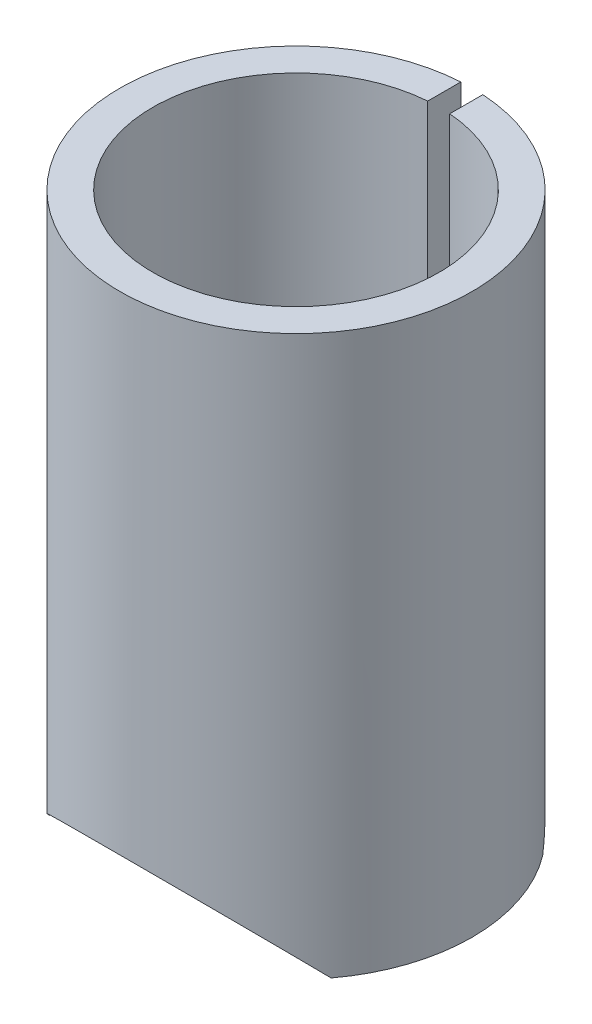
from build123d import *

# Parameters (mm, degrees)
BOSS_EXTRUDE1_DEPTH     = 50.8
CUT_EXTRUDE1_DEPTH      = 50.8
CUT_EXTRUDE1_DEPTH_BACK = 50.8
SKETCH2_R               = 15.875


with BuildPart() as part:
    # Sketch1 → Boss-Extrude1 (new body)
    with BuildSketch(Plane(origin=(0, 0, 0), x_dir=(1, 0, 0), z_dir=(0, 1, 0))):
        with BuildLine():
            Line((-1, 15.968719423), (-1, 12.961481397))
            ThreePointArc((-1, 12.961481397), (0, -13), (1, 12.961481397))
            Line((1, 12.961481397), (1, 15.968719423))
            ThreePointArc((1, 15.968719423), (0, -16), (-1, 15.968719423))
        make_face()
    extrude(amount=BOSS_EXTRUDE1_DEPTH)

    # Sketch2 → Cut-Extrude1 (cut, two sides: drawn at the far end of the back side and taken through both)
    with BuildSketch(Plane.XY.offset(-CUT_EXTRUDE1_DEPTH_BACK)):
        with Locations((0, -9.398568911)):
            Circle(SKETCH2_R)
    extrude(amount=CUT_EXTRUDE1_DEPTH + CUT_EXTRUDE1_DEPTH_BACK, mode=Mode.SUBTRACT)


solid = part.part
